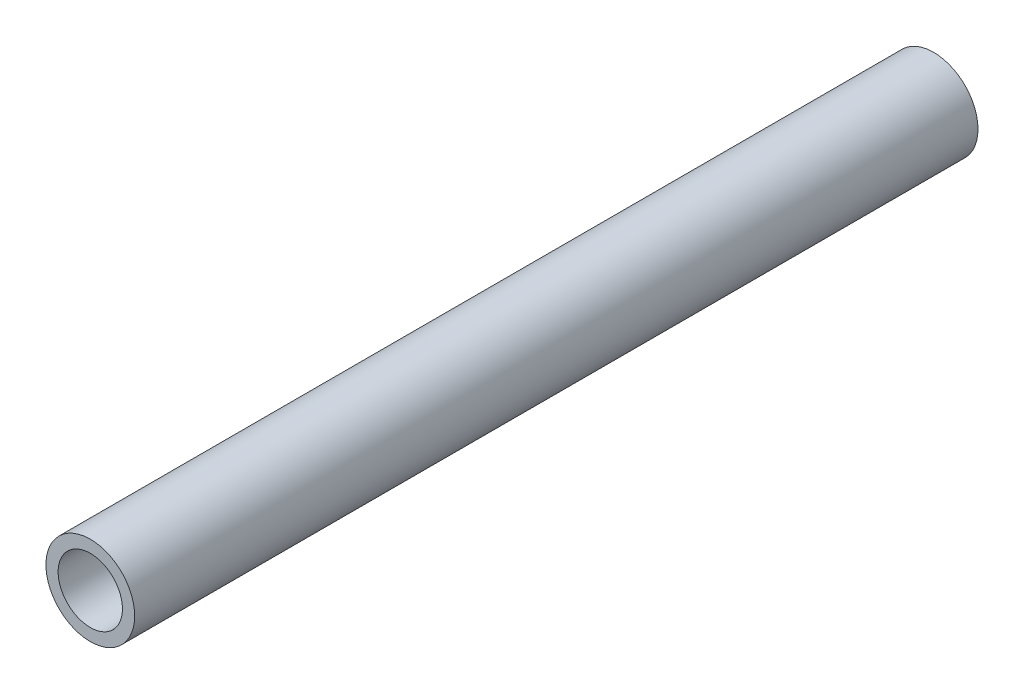
from build123d import *

# Parameters (mm, degrees)
SKETCH1_R           = 10.6934
SKETCH1_R_2         = 7.747
BOSS_EXTRUDE1_DEPTH = 203.2


with BuildPart() as part:
    # Sketch1 → Boss-Extrude1 (new body)
    with BuildSketch(Plane.XY):
        Circle(SKETCH1_R)
        Circle(SKETCH1_R_2, mode=Mode.SUBTRACT)
    extrude(amount=BOSS_EXTRUDE1_DEPTH)


solid = part.part
